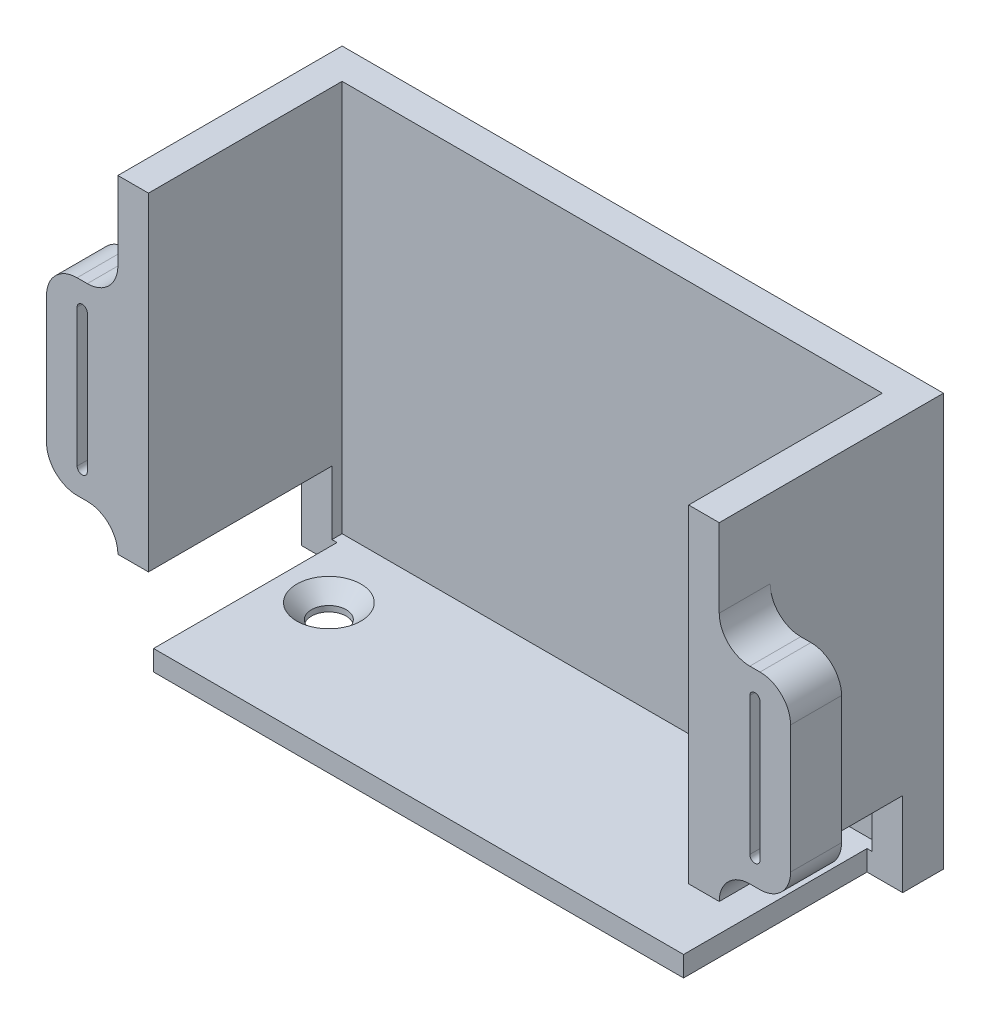
from build123d import *

# Parameters (mm, degrees)
SKETCH5_W                                      = 53
SKETCH5_H                                      = 37
BOSS_EXTRUDE3_DEPTH                            = 3
BOSS_EXTRUDE4_DEPTH                            = 19
BOSS_EXTRUDE4_DEPTH_BACK                       = 3
SKETCH6_W                                      = 3
SKETCH6_H                                      = 37
SKETCH7_W                                      = 7
SKETCH7_H                                      = 18.5
BOSS_EXTRUDE5_DEPTH                            = 5
FILLET3_R                                      = 3
SKETCH8_W                                      = 59
SKETCH8_H                                      = 22
SKETCH8_R                                      = 0.5
BOSS_EXTRUDE6_DEPTH                            = 2
CSK_FOR_M3_FLAT_HEAD_MACHINE_SCREW1_AT_2_COUNT = 2
CSK_FOR_M3_FLAT_HEAD_MACHINE_SCREW1_AT_2_PITCH = 42.6
BOSS_EXTRUDE7_DEPTH                            = 1.44
SKETCH11_W                                     = 18
SKETCH11_H                                     = 8.25
CUT_EXTRUDE1_DEPTH                             = 3.5
SKETCH12_W                                     = 18
SKETCH12_H                                     = 8.25
CUT_EXTRUDE2_DEPTH                             = 3.5


with BuildPart() as part:
    # Sketch5 → Boss-Extrude3 (new body)
    with BuildSketch(Plane.XY):
        with Locations((26.5, 18.5)):
            Rectangle(SKETCH5_W, SKETCH5_H)
    extrude(amount=BOSS_EXTRUDE3_DEPTH)

    # Sketch6 → Boss-Extrude4 (add, two sides: drawn at the far end of the back side and taken through both)
    with BuildSketch(Plane.XY.offset(3).offset(-BOSS_EXTRUDE4_DEPTH_BACK)):
        with Locations((-1.5, 18.5)):
            Rectangle(SKETCH6_W, SKETCH6_H)
        with Locations((54.5, 18.5)):
            Rectangle(SKETCH6_W, SKETCH6_H)
    extrude(amount=BOSS_EXTRUDE4_DEPTH + BOSS_EXTRUDE4_DEPTH_BACK)

    # Sketch7 → Boss-Extrude5 (add)
    # profile 1 of 2: a face of its own
    with BuildSketch(Plane.XY.offset(22)):
        with Locations((-6.5, 18.5)):
            Rectangle(SKETCH7_W, SKETCH7_H)
        with BuildLine():
            Line((-6, 25.25), (-6, 11.75))
            ThreePointArc((-6, 11.75), (-6.5, 11.25), (-7, 11.75))
            Line((-7, 11.75), (-7, 25.25))
            ThreePointArc((-7, 25.25), (-6.5, 25.75), (-6, 25.25))
        make_face(mode=Mode.SUBTRACT)
    # profile 2 of 2: a face of its own
    with BuildSketch(Plane.XY.offset(22)):
        with Locations((59.5, 18.5)):
            Rectangle(SKETCH7_W, SKETCH7_H)
        with BuildLine():
            Line((59, 25.25), (59, 11.75))
            ThreePointArc((59, 11.75), (59.5, 11.25), (60, 11.75))
            Line((60, 11.75), (60, 25.25))
            ThreePointArc((60, 25.25), (59.5, 25.75), (59, 25.25))
        make_face(mode=Mode.SUBTRACT)
    extrude(amount=-BOSS_EXTRUDE5_DEPTH)

    # Fillet3
    fillet3_edges = [part.edges().sort_by_distance(p)[0] for p in [
        (-3, 27.75, 19.5),
        (-3, 9.25, 19.5),
        (-10, 9.25, 19.5),
        (-10, 27.75, 19.5),
        (63, 9.25, 19.5),
        (56, 9.25, 19.5),
        (56, 27.75, 19.5),
        (63, 27.75, 19.5),
    ]]
    fillet(fillet3_edges, radius=FILLET3_R)

    # Sketch8 → Boss-Extrude6 (add)
    with BuildSketch(Plane.XZ):
        with Locations((26.5, 11)):
            Rectangle(SKETCH8_W, SKETCH8_H)
        with Locations((5.2, 9.5)):
            Circle(SKETCH8_R, mode=Mode.SUBTRACT)
        with Locations((47.8, 9.5)):
            Circle(SKETCH8_R, mode=Mode.SUBTRACT)
    extrude(amount=BOSS_EXTRUDE6_DEPTH)

    # Sketch9 → CSK for M3 Flat Head Machine Screw1 (revolve, cut)
    with BuildSketch(Plane(origin=(5.2, 0, 9.5), x_dir=(0, 0, 1), z_dir=(1, 0, 0))):
        Polygon((0, 0), (0, 2), (1.7, 2), (1.7, 1.45), (3.15, 0), align=None)
    csk_for_m3_flat_head_machine_screw1 = revolve(axis=Axis((5.2, 6.35, 9.5), (0, -1, 0)), mode=Mode.SUBTRACT)

    # CSK for M3 Flat Head Machine Screw1 at 2: CSK for M3 Flat Head Machine Screw1 ×2
    with Locations(*[(i * CSK_FOR_M3_FLAT_HEAD_MACHINE_SCREW1_AT_2_PITCH, 0, 0) for i in range(1, CSK_FOR_M3_FLAT_HEAD_MACHINE_SCREW1_AT_2_COUNT)]):
        add(csk_for_m3_flat_head_machine_screw1, mode=Mode.SUBTRACT)

    # Sketch10 → Boss-Extrude7 (add)
    with BuildSketch(Plane(origin=(0, 37, 0), x_dir=(1, 0, 0), z_dir=(0, 1, 0))):
        Polygon((0, -22), (-3, -22), (-3, 0), (56, 0), (56, -22), (53, -22), (53, -3), (0, -3), align=None)
    extrude(amount=BOSS_EXTRUDE7_DEPTH)

    # Sketch11 → Cut-Extrude1 (cut)
    with BuildSketch(Plane.ZY.offset(3)):
        with Locations((13, 2.125)):
            Rectangle(SKETCH11_W, SKETCH11_H)
    extrude(amount=-CUT_EXTRUDE1_DEPTH, mode=Mode.SUBTRACT)

    # Sketch12 → Cut-Extrude2 (cut)
    with BuildSketch(Plane(origin=(56, 0, 0), x_dir=(0, 0, -1), z_dir=(1, 0, 0))):
        with Locations((-13, 2.125)):
            Rectangle(SKETCH12_W, SKETCH12_H)
    extrude(amount=-CUT_EXTRUDE2_DEPTH, mode=Mode.SUBTRACT)


solid = part.part
